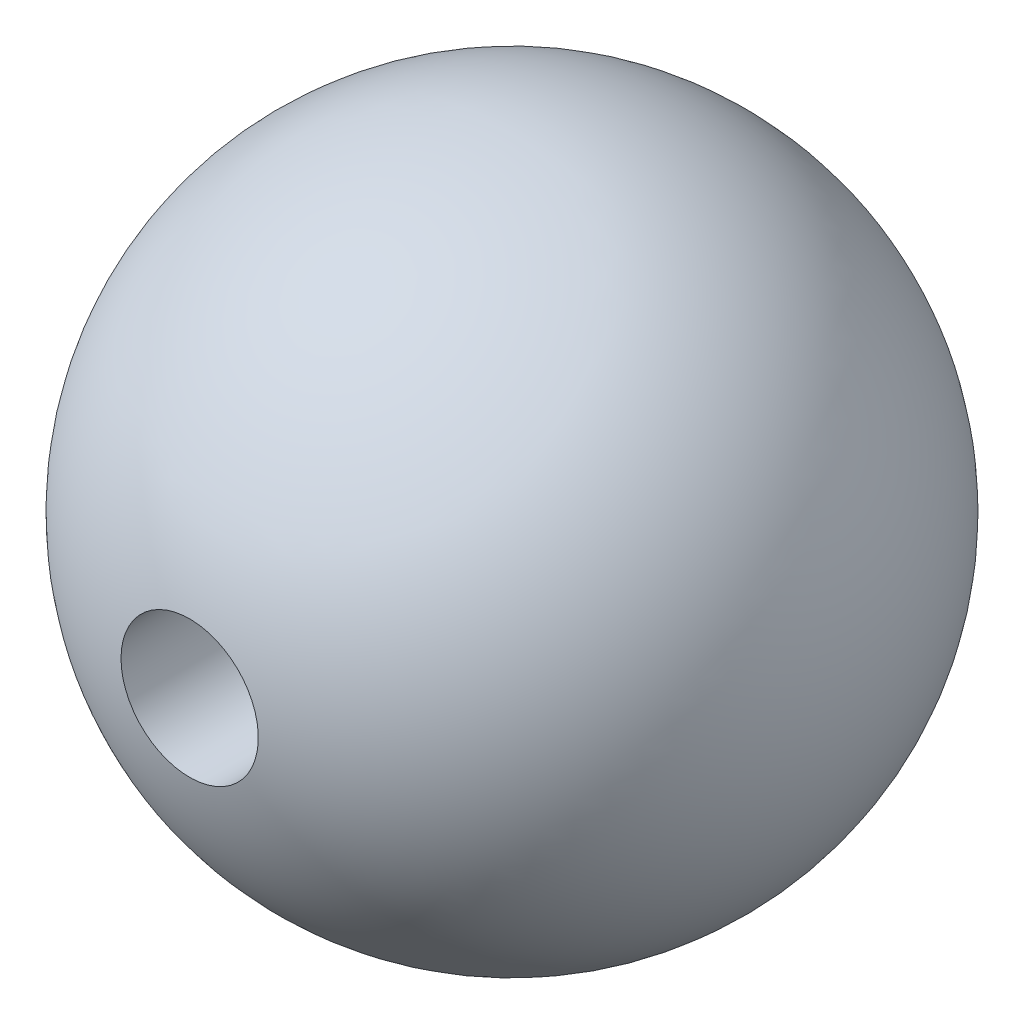
from build123d import *

# Parameters (mm, degrees)
ESQUISSE3_R             = 0.25
ENL_V_MAT_EXTRU_1_DEPTH = 5


with BuildPart() as part:
    # Esquisse2 → Base-Révolution (revolve)
    with BuildSketch(Plane.XY):
        with BuildLine():
            Line((1.2, 0), (-1.2, 0))
            ThreePointArc((-1.2, 0), (0, 1.2), (1.2, 0))
        make_face()
    revolve(axis=Axis((-11.2, 0, 0), (1, 0, 0)))

    # Esquisse3 → Enlèv. mat.-Extru.1 (cut, symmetric)
    with BuildSketch(Plane.XY):
        with Locations(Location((0, 0, 0), (0, 0, 180))):
            Circle(ESQUISSE3_R)
    extrude(amount=ENL_V_MAT_EXTRU_1_DEPTH, both=True, mode=Mode.SUBTRACT)


solid = part.part
